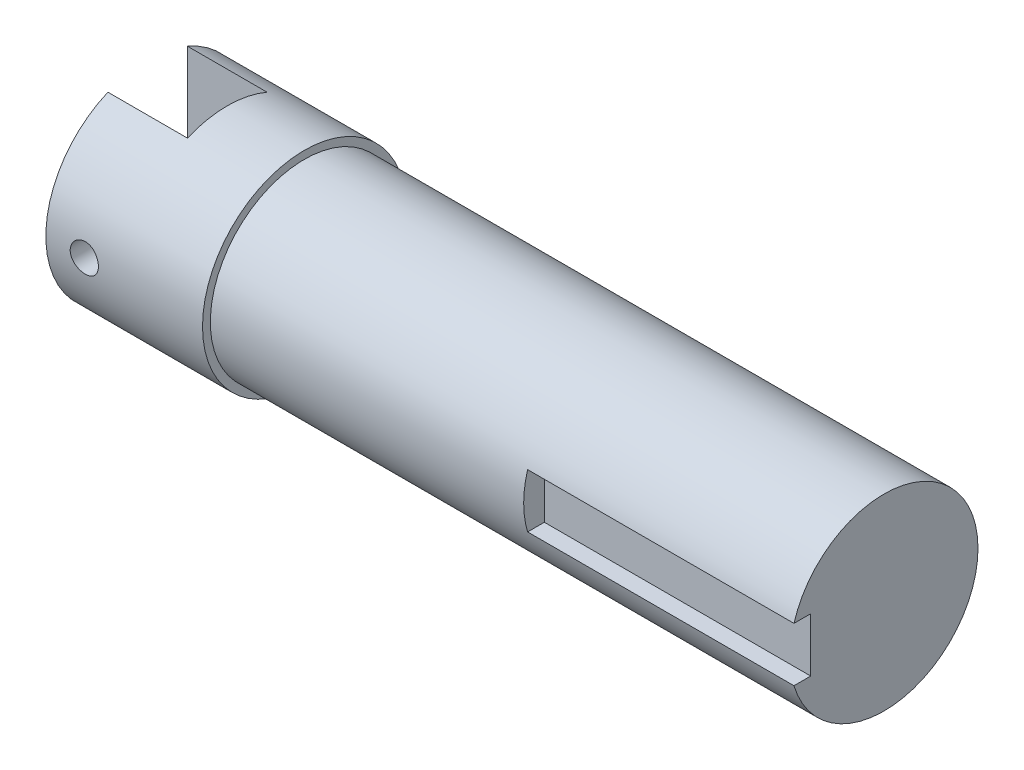
from build123d import *

# Parameters (mm, degrees)
SKETCH1_R               = 30
BOSS_EXTRUDE1_DEPTH     = 185
SKETCH2_R               = 32.5
BOSS_EXTRUDE2_DEPTH     = 50
SKETCH3_W               = 17.227034698
SKETCH3_H               = 11
CUT_EXTRUDE1_DEPTH      = 85
SKETCH6_W               = 97.129715822
SKETCH6_H               = 25.4
CUT_EXTRUDE2_DEPTH      = 25.4
CUT_EXTRUDE3_DEPTH      = 66.4
CUT_EXTRUDE3_DEPTH_BACK = 25.4
SKETCH7_R               = 4.5


with BuildPart() as part:
    # Sketch1 → Boss-Extrude1 (new body)
    with BuildSketch(Plane.YZ):
        with Locations(Location((0, 0, 0), (0, 0, 270))):
            Circle(SKETCH1_R)
    extrude(amount=BOSS_EXTRUDE1_DEPTH)

    # Sketch2 → Boss-Extrude2 (add)
    with BuildSketch(Plane.ZY):
        Circle(SKETCH2_R)
    extrude(amount=BOSS_EXTRUDE2_DEPTH)

    # Sketch3 → Cut-Extrude1 (cut)
    with BuildSketch(Plane.YZ.offset(185)):
        with Locations((0, 28.9)):
            Rectangle(SKETCH3_W, SKETCH3_H)
    extrude(amount=-CUT_EXTRUDE1_DEPTH, mode=Mode.SUBTRACT)

    # Sketch6 → Cut-Extrude2 (cut)
    with BuildSketch(Plane(origin=(-50, 0, 0), x_dir=(0, -1, 0), z_dir=(-1, 0, 0))):
        with Locations((3.400411954, 0)):
            Rectangle(SKETCH6_W, SKETCH6_H)
    extrude(amount=-CUT_EXTRUDE2_DEPTH, mode=Mode.SUBTRACT)

    # Sketch7 → Cut-Extrude3 (cut, two sides: drawn at the far end of the back side and taken through both)
    with BuildSketch(Plane.XY.offset(-12.7).offset(-CUT_EXTRUDE3_DEPTH_BACK)):
        with Locations(Location((-37.729755698, 0, 0), (0, 0, 180))):
            Circle(SKETCH7_R)
    extrude(amount=CUT_EXTRUDE3_DEPTH + CUT_EXTRUDE3_DEPTH_BACK, mode=Mode.SUBTRACT)


solid = part.part
